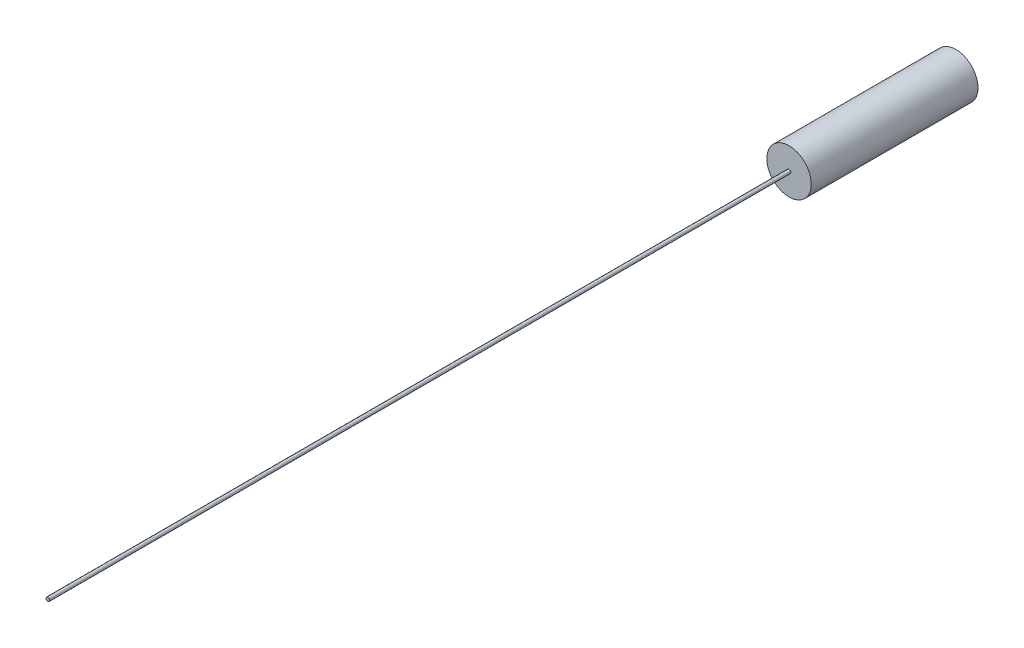
from build123d import *

# Parameters (mm, degrees)
SKETCH1_R           = 6
BOSS_EXTRUDE1_DEPTH = 45
SKETCH2_R           = 0.5
BOSS_EXTRUDE2_DEPTH = 200


with BuildPart() as part:
    # Sketch1 → Boss-Extrude1 (new body)
    with BuildSketch(Plane.XY):
        with Locations(Location((0, 0, 0), (0, 0, 180))):
            Circle(SKETCH1_R)
    extrude(amount=BOSS_EXTRUDE1_DEPTH)

    # Sketch2 → Boss-Extrude2 (add)
    with BuildSketch(Plane.XY.offset(45)):
        Circle(SKETCH2_R)
    extrude(amount=BOSS_EXTRUDE2_DEPTH)


solid = part.part
